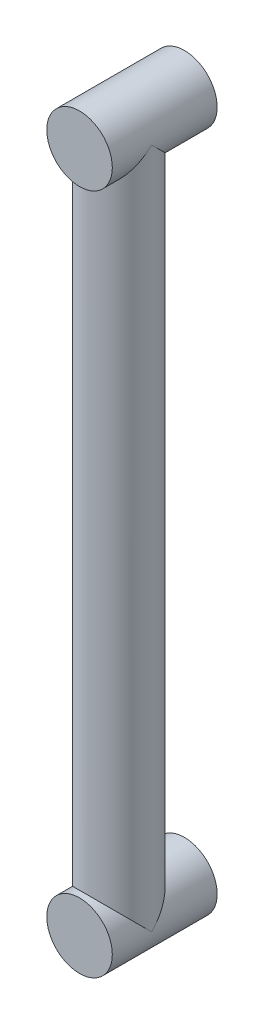
from build123d import *

# Parameters (mm, degrees)
SKETCH_1_R             = 250
EXTRUDE_1_DEPTH        = 800
SKETCH_2_R             = 250
EXTRUDE_2_DEPTH        = 5200
PATTERN_LINEAR_1_COUNT = 2
PATTERN_LINEAR_1_PITCH = 5200


with BuildPart() as part:
    # 草图1 → 凸台-拉伸1 (new body)
    with BuildSketch(Plane.XY):
        Circle(SKETCH_1_R)
    extrude_1 = extrude(amount=EXTRUDE_1_DEPTH)

    # 草图2 → 凸台-拉伸2 (add)
    with BuildSketch(Plane(origin=(0, 0, 0), x_dir=(1, 0, 0), z_dir=(0, 1, 0))):
        with Locations((0, -500)):
            Circle(SKETCH_2_R)
    extrude(amount=EXTRUDE_2_DEPTH)

    # 阵列(线性)1: 凸台-拉伸1 ×2
    with Locations(*[(0, i * PATTERN_LINEAR_1_PITCH, 0) for i in range(1, PATTERN_LINEAR_1_COUNT)]):
        add(extrude_1)


solid = part.part
